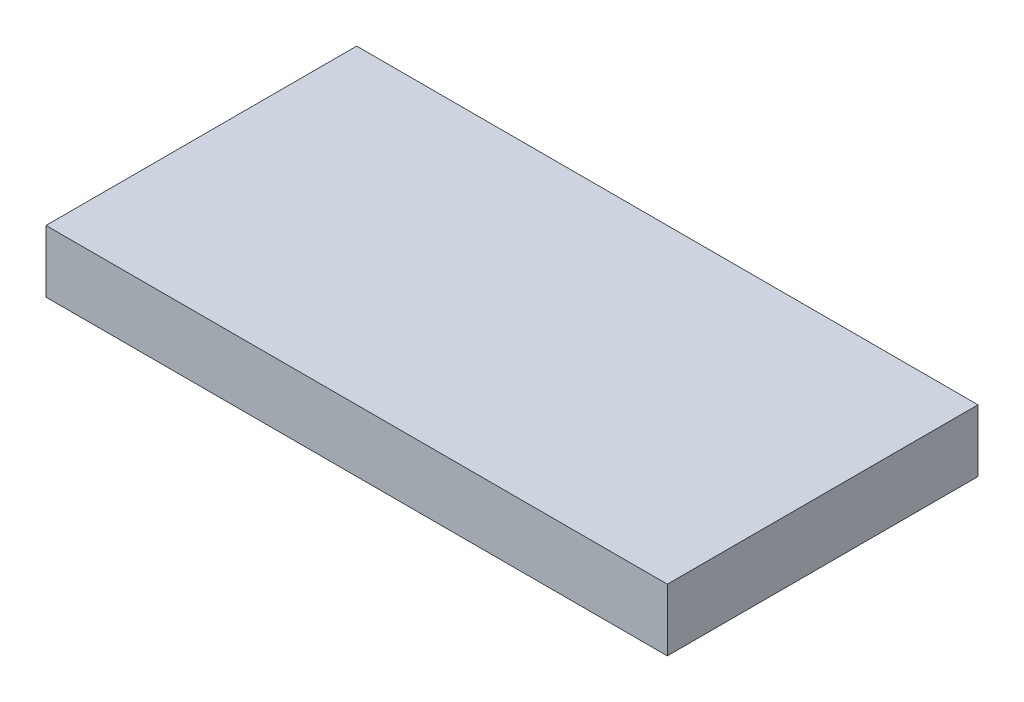
from build123d import *

# Parameters (mm, degrees)
SKETCH1_W           = 40
SKETCH1_H           = 20
BOSS_EXTRUDE1_DEPTH = 4


with BuildPart() as part:
    # Sketch1 → Boss-Extrude1 (new body)
    with BuildSketch(Plane(origin=(0, 0, 0), x_dir=(1, 0, 0), z_dir=(0, 1, 0))):
        with Locations((20, 10)):
            Rectangle(SKETCH1_W, SKETCH1_H)
    extrude(amount=-BOSS_EXTRUDE1_DEPTH)


solid = part.part
